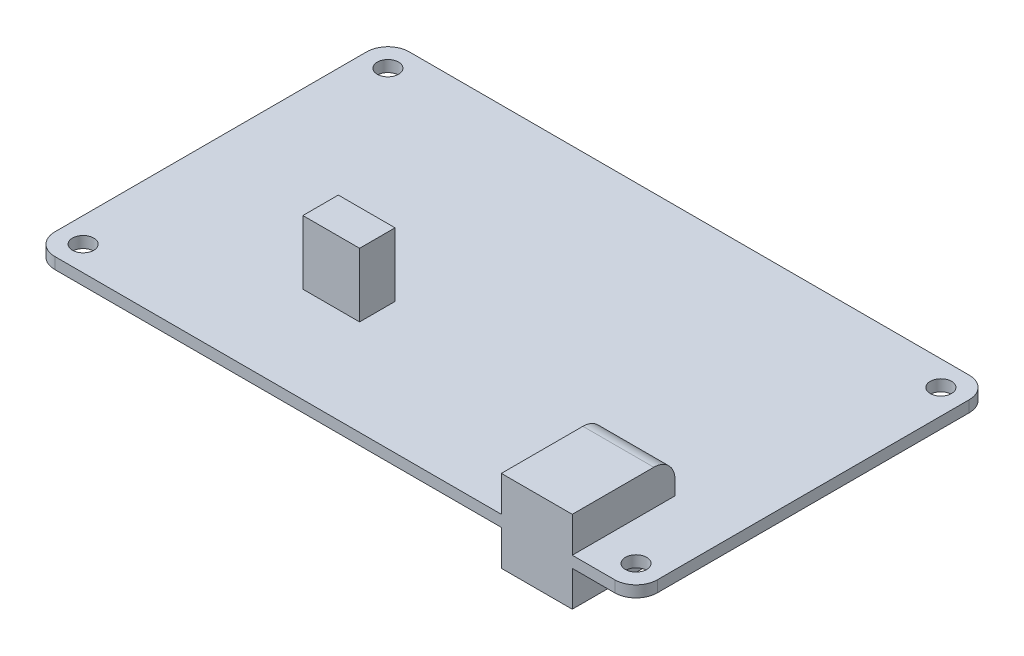
from build123d import *

# Parameters (mm, degrees)
SKETCH_1_W      = 85
SKETCH_1_H      = 50
SKETCH_1_R      = 1.5
EXTRUDE_1_DEPTH = 1.6
FILLET_1_R      = 3
SKETCH_2_W      = 10
SKETCH_2_H      = 14.5
EXTRUDE_2_DEPTH = 5
SKETCH_3_W      = 8
SKETCH_3_H      = 5
EXTRUDE_3_DEPTH = 9
SKETCH_4_W      = 10
SKETCH_4_H      = 14.5
EXTRUDE_4_DEPTH = 5
FILLET_2_R      = 3


with BuildPart() as part:
    # 草图1 → 凸台-拉伸1 (new body)
    with BuildSketch(Plane(origin=(0, 0, 0), x_dir=(1, 0, 0), z_dir=(0, 1, 0))):
        Rectangle(SKETCH_1_W, SKETCH_1_H)
        with Locations(Location((-39, 21.5, 0), (0, 0, 270))):
            Circle(SKETCH_1_R, mode=Mode.SUBTRACT)
        with Locations(Location((39, 21.5, 0), (0, 0, 270))):
            Circle(SKETCH_1_R, mode=Mode.SUBTRACT)
        with Locations(Location((39, -21.5, 0), (0, 0, 270))):
            Circle(SKETCH_1_R, mode=Mode.SUBTRACT)
        with Locations(Location((-39, -21.5, 0), (0, 0, 270))):
            Circle(SKETCH_1_R, mode=Mode.SUBTRACT)
    extrude(amount=EXTRUDE_1_DEPTH)

    # 圆角1
    fillet_1_edges = [part.edges().sort_by_distance(p)[0] for p in [
        (42.5, 0.8, 25),
        (-42.5, 0.8, 25),
        (-42.5, 0.8, -25),
        (42.5, 0.8, -25),
    ]]
    fillet(fillet_1_edges, radius=FILLET_1_R)

    # 草图2 → 凸台-拉伸2 (add)
    with BuildSketch(Plane(origin=(0, 1.6, 0), x_dir=(1, 0, 0), z_dir=(0, 1, 0))):
        with Locations((28.5, -17.75)):
            Rectangle(SKETCH_2_W, SKETCH_2_H)
    extrude(amount=EXTRUDE_2_DEPTH)

    # 草图3 → 凸台-拉伸3 (add)
    with BuildSketch(Plane(origin=(0, 1.6, 0), x_dir=(1, 0, 0), z_dir=(0, 1, 0))):
        with Locations((-14, -9)):
            Rectangle(SKETCH_3_W, SKETCH_3_H)
    extrude(amount=EXTRUDE_3_DEPTH)

    # 草图4 → 凸台-拉伸4 (add)
    with BuildSketch(Plane.XZ):
        with Locations((28.5, 17.75)):
            Rectangle(SKETCH_4_W, SKETCH_4_H)
    extrude(amount=EXTRUDE_4_DEPTH)

    # 圆角2
    fillet_2_edges = [part.edges().sort_by_distance(p)[0] for p in [
        (28.5, 6.6, 10.5),
        (28.5, -5, 10.5),
    ]]
    fillet(fillet_2_edges, radius=FILLET_2_R)


solid = part.part
